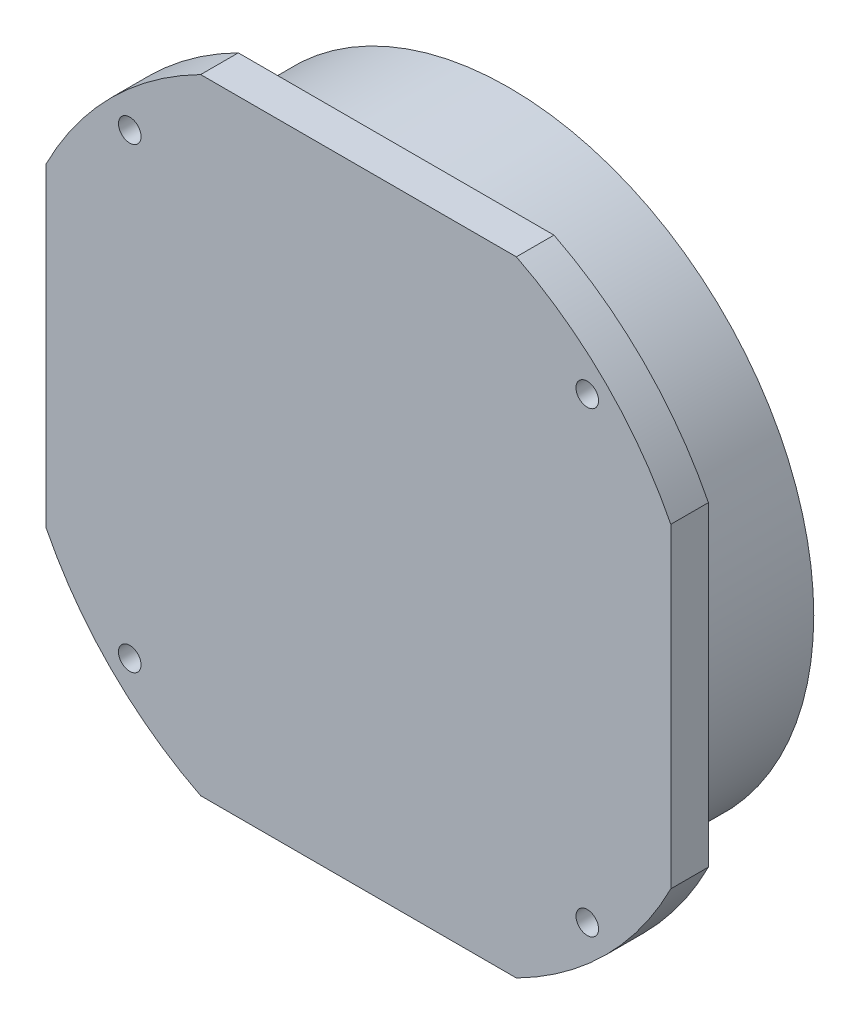
from build123d import *

# Parameters (mm, degrees)
EXTRUDE_1_DEPTH     = 5
SKETCH_2_R          = 1.5
CUT_EXTRUDE_1_DEPTH = 19
SKETCH_3_R          = 40.5
EXTRUDE_2_DEPTH     = 15
EXTRUDE_3_DEPTH     = 1
SKETCH_7_W          = 0.4
SKETCH_7_H          = 0.4
SKETCH_7_W_2        = 0.2
SKETCH_7_H_2        = 0.8
EXTRUDE_4_DEPTH     = 7
SKETCH_8_R          = 1.65
SKETCH_8_R_2        = 1.5
CUT_EXTRUDE_2_DEPTH = 0.5
CUT_EXTRUDE_3_DEPTH = 0.5


with BuildPart() as part:
    # 草图1 → 凸台-拉伸1 (new body)
    with BuildSketch(Plane.XY):
        with BuildLine():
            Line((-20.976176963, 41.5), (20.976176963, 41.5))
            ThreePointArc((20.976176963, 41.5), (32.880465325, 32.880465325), (41.5, 20.976176963))
            Line((41.5, 20.976176963), (41.5, -20.976176963))
            ThreePointArc((41.5, -20.976176963), (32.880465325, -32.880465325), (20.976176963, -41.5))
            Line((20.976176963, -41.5), (-20.976176963, -41.5))
            ThreePointArc((-20.976176963, -41.5), (-32.880465325, -32.880465325), (-41.5, -20.976176963))
            Line((-41.5, -20.976176963), (-41.5, 20.976176963))
            ThreePointArc((-41.5, 20.976176963), (-32.880465325, 32.880465325), (-20.976176963, 41.5))
        make_face()
    extrude(amount=EXTRUDE_1_DEPTH)

    # 草图2 → 切除-拉伸1 (cut)
    with BuildSketch(Plane.XY.offset(5)):
        with Locations((-30.4, 30.4)):
            Circle(SKETCH_2_R)
        with Locations((30.4, 30.4)):
            Circle(SKETCH_2_R)
        with Locations((30.4, -30.4)):
            Circle(SKETCH_2_R)
        with Locations((-30.4, -30.4)):
            Circle(SKETCH_2_R)
    extrude(amount=-CUT_EXTRUDE_1_DEPTH, mode=Mode.SUBTRACT)

    # 草图3 → 凸台-拉伸2 (add)
    with BuildSketch(Plane(origin=(0, 0, 0), x_dir=(-1, 0, 0), z_dir=(0, 0, -1))):
        with Locations(Location((0, 0, 0), (0, 0, 180))):
            Circle(SKETCH_3_R)
    extrude(amount=EXTRUDE_2_DEPTH)

    # 草图6 → 凸台-拉伸3 (add)
    with BuildSketch(Plane(origin=(0, 0, -15), x_dir=(-1, 0, 0), z_dir=(0, 0, -1))):
        with BuildLine():
            Line((-18, -5.75), (-18, -7.75))
            Line((-18, -7.75), (-22, -7.75))
            Line((-22, -7.75), (-22, -5.75))
            ThreePointArc((-22, -5.75), (-21.853553391, -5.396446609), (-21.5, -5.25))
            Line((-21.5, -5.25), (-18.5, -5.25))
            ThreePointArc((-18.5, -5.25), (-18.146446609, -5.396446609), (-18, -5.75))
        make_face()
        with BuildLine():
            Line((-21.5, -8.25), (-18.5, -8.25))
            ThreePointArc((-18.5, -8.25), (-18.146446609, -8.396446609), (-18, -8.75))
            Line((-18, -8.75), (-18, -10.75))
            Line((-18, -10.75), (-22, -10.75))
            Line((-22, -10.75), (-22, -8.75))
            ThreePointArc((-22, -8.75), (-21.853553391, -8.396446609), (-21.5, -8.25))
        make_face()
        with BuildLine():
            Line((-18, -2.75), (-18, -4.75))
            Line((-18, -4.75), (-22, -4.75))
            Line((-22, -4.75), (-22, -2.75))
            ThreePointArc((-22, -2.75), (-21.853553391, -2.396446609), (-21.5, -2.25))
            Line((-21.5, -2.25), (-18.5, -2.25))
            ThreePointArc((-18.5, -2.25), (-18.146446609, -2.396446609), (-18, -2.75))
        make_face()
        with BuildLine():
            Line((-21.5, -11.25), (-18.5, -11.25))
            ThreePointArc((-18.5, -11.25), (-18.146446609, -11.396446609), (-18, -11.75))
            Line((-18, -11.75), (-18, -13.75))
            Line((-18, -13.75), (-22, -13.75))
            Line((-22, -13.75), (-22, -11.75))
            ThreePointArc((-22, -11.75), (-21.853553391, -11.396446609), (-21.5, -11.25))
        make_face()
        with BuildLine():
            Line((-22, -14.75), (-22, -16.75))
            Line((-22, -16.75), (-18, -16.75))
            Line((-18, -16.75), (-18, -14.75))
            ThreePointArc((-18, -14.75), (-18.146446609, -14.396446609), (-18.5, -14.25))
            Line((-18.5, -14.25), (-21.5, -14.25))
            ThreePointArc((-21.5, -14.25), (-21.853553391, -14.396446609), (-22, -14.75))
        make_face()
    extrude(amount=EXTRUDE_3_DEPTH)

    # 草图7 → 凸台-拉伸4 (add)
    with BuildSketch(Plane(origin=(0, 0, -16), x_dir=(-1, 0, 0), z_dir=(0, 0, -1))):
        with Locations((-19.248388447, -6.540012069)):
            Rectangle(SKETCH_7_W, SKETCH_7_H)
        with Locations((-20.931423751, -3.588755831)):
            Rectangle(SKETCH_7_W_2, SKETCH_7_H_2)
        with Locations((-19.248388447, -3.588755831)):
            Rectangle(SKETCH_7_W, SKETCH_7_H)
        with Locations((-20.931423751, -6.540012069)):
            Rectangle(SKETCH_7_W_2, SKETCH_7_H_2)
        with Locations((-19.248388447, -9.597001128)):
            Rectangle(SKETCH_7_W, SKETCH_7_H)
        with Locations((-20.931423751, -9.597001128)):
            Rectangle(SKETCH_7_W_2, SKETCH_7_H_2)
        with Locations((-20.931423751, -12.516173633)):
            Rectangle(SKETCH_7_W_2, SKETCH_7_H_2)
        with Locations((-19.248388447, -12.516173633)):
            Rectangle(SKETCH_7_W, SKETCH_7_H)
        with Locations((-19.248388447, -15.44492275)):
            Rectangle(SKETCH_7_W, SKETCH_7_H)
        with Locations((-20.931423751, -15.44492275)):
            Rectangle(SKETCH_7_W_2, SKETCH_7_H_2)
    extrude(amount=EXTRUDE_4_DEPTH)

    # 草图8 → 切除-拉伸2 (cut)
    # profile 1 of 2: a face of its own
    with BuildSketch(Plane(origin=(0, 0, -15), x_dir=(-1, 0, 0), z_dir=(0, 0, -1))):
        with Locations((-20, 0)):
            Circle(SKETCH_8_R)
        with Locations((-20, 0)):
            Circle(SKETCH_8_R_2, mode=Mode.SUBTRACT)
    # profile 2 of 2: a face of its own
    with BuildSketch(Plane(origin=(0, 0, -15), x_dir=(-1, 0, 0), z_dir=(0, 0, -1))):
        with Locations((-20, -19)):
            Circle(SKETCH_8_R)
        with Locations((-20, -19)):
            Circle(SKETCH_8_R_2, mode=Mode.SUBTRACT)
    extrude(amount=-CUT_EXTRUDE_2_DEPTH, mode=Mode.SUBTRACT)

    # 草图9 → 切除-拉伸3 (cut)
    with BuildSketch(Plane(origin=(0, 0, -15), x_dir=(-1, 0, 0), z_dir=(0, 0, -1))):
        with BuildLine():
            Line((-21.300685051, 0.747140146), (-19.096187693, -1.197131285))
            ThreePointArc((-19.096187693, -1.197131285), (-18.875022153, -0.99218186), (-18.699314949, -0.747140146))
            Line((-18.699314949, -0.747140146), (-20.903812307, 1.197131285))
            ThreePointArc((-20.903812307, 1.197131285), (-21.124977847, 0.99218186), (-21.300685051, 0.747140146))
        make_face()
        with BuildLine():
            Line((-21.300685051, -18.252859854), (-19.096187693, -20.197131285))
            ThreePointArc((-19.096187693, -20.197131285), (-18.875022153, -19.99218186), (-18.699314949, -19.747140146))
            Line((-18.699314949, -19.747140146), (-20.903812307, -17.802868715))
            ThreePointArc((-20.903812307, -17.802868715), (-21.124977847, -18.00781814), (-21.300685051, -18.252859854))
        make_face()
    extrude(amount=-CUT_EXTRUDE_3_DEPTH, mode=Mode.SUBTRACT)


solid = part.part
